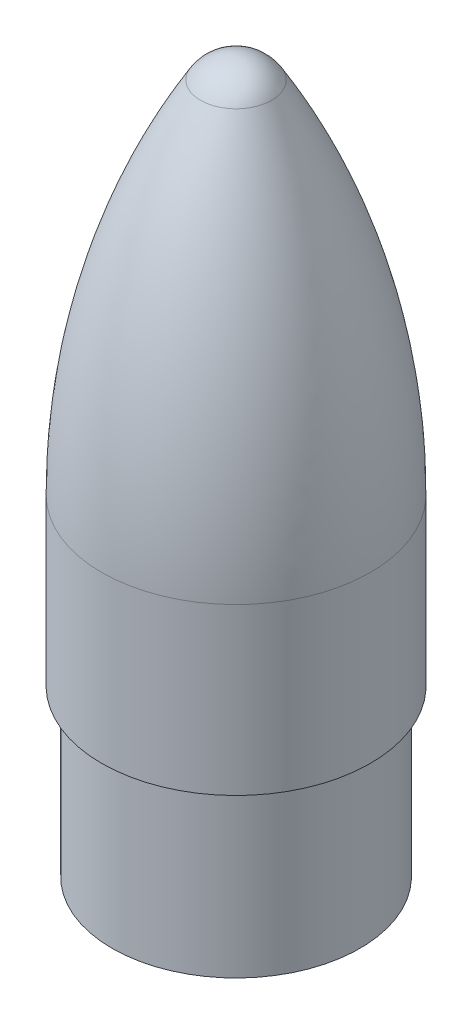
from build123d import *

# Parameters (mm, degrees)
SKETCH1_R           = 38.1
BOSS_EXTRUDE1_DEPTH = 50.8
SKETCH2_R           = 41.275
BOSS_EXTRUDE2_DEPTH = 50.8


with BuildPart() as part:
    # Sketch1 → Boss-Extrude1 (new body)
    with BuildSketch(Plane(origin=(0, 0, 0), x_dir=(1, 0, 0), z_dir=(0, 1, 0))):
        with Locations(Location((0, 0, 0), (0, 0, 270))):
            Circle(SKETCH1_R)
    extrude(amount=BOSS_EXTRUDE1_DEPTH)

    # Sketch2 → Boss-Extrude2 (add)
    with BuildSketch(Plane(origin=(0, 50.8, 0), x_dir=(1, 0, 0), z_dir=(0, 1, 0))):
        with Locations(Location((0, 0, 0), (0, 0, 270))):
            Circle(SKETCH2_R)
    extrude(amount=BOSS_EXTRUDE2_DEPTH)

    # Sketch3 → Revolve17 (revolve)
    with BuildSketch(Plane.XY):
        with BuildLine():
            Line((0, 214.429060371), (0, 218.239060371))
            ThreePointArc((0, 218.239060371), (-6.278456146, 216.578582298), (-10.915144585, 212.031350247))
            add(Edge.make_bspline(
                [(-41.275, 101.6), (-41.275, 101.930502855), (-41.273557103, 102.40564964), (-41.268747446, 103.512092248), (-41.257925909, 104.319246857), (-41.246383117, 105.163883335), (-41.228347866, 106.135820012), (-41.200734551, 107.334179726), (-41.159757311, 108.729726347), (-41.100846347, 110.335373987), (-41.029571588, 111.946697142), (-40.946255064, 113.558844584), (-40.850901423, 115.169512919), (-40.743515987, 116.779892998), (-40.624104745, 118.389166096), (-40.459816828, 120.399743968), (-40.238647793, 122.810299788), (-39.945617875, 125.619277994), (-39.562802148, 128.824148418), (-38.809156369, 134.422061303), (-36.96766496, 145.570323281), (-33.49128341, 160.52369707), (-28.30812049, 176.263796505), (-22.487129194, 190.02095936), (-18.428836954, 198.367582764), (-16.193226279, 202.662272388), (-14.657371604, 205.491195217), (-13.781700582, 207.066687496), (-13.19565908, 208.105983946), (-12.707159013, 208.962552916), (-12.311115433, 209.650979413), (-11.92041177, 210.324783551), (-11.526473808, 210.998380475), (-11.168679866, 211.6041541), (-10.999621727, 211.88932335), (-10.915144585, 212.031350247)],
                knots=[0.08301761, 0.08301761, 0.08301761, 0.08301761, 0.08301761, 0.094422695, 0.100125237, 0.105827779, 0.111530322, 0.117232864, 0.128637949, 0.140293389, 0.15194883, 0.163604271, 0.175259711, 0.186915153, 0.198570596, 0.210226038, 0.22188148, 0.245192344, 0.268503208, 0.291814091, 0.315124974, 0.408368487, 0.594855494, 0.734720752, 0.792997941, 0.839619695, 0.862930572, 0.87458601, 0.885991093, 0.891693634, 0.897396175, 0.903098717, 0.908801258, 0.914503799, 0.920206341, 0.920206341, 0.920206341, 0.920206341, 0.920206341], degree=4))
            Line((-41.275, 101.6), (-37.465, 101.6))
            add(Edge.make_bspline(
                [(-37.465, 101.6), (-37.465, 101.930502867), (-37.463557103, 102.405649652), (-37.458747445, 103.51209226), (-37.447925909, 104.31924687), (-37.436383117, 105.163883348), (-37.418347866, 106.135820025), (-37.39073455, 107.334179738), (-37.349757311, 108.729726359), (-37.290846347, 110.335373999), (-37.219571587, 111.946697154), (-37.136255063, 113.558844596), (-37.040901422, 115.169512931), (-36.933515986, 116.779893011), (-36.814104744, 118.389166108), (-36.649816827, 120.39974398), (-36.428647791, 122.8102998), (-36.135617873, 125.619278007), (-35.752802146, 128.82414843), (-34.999156367, 134.422061315), (-33.157664958, 145.570323293), (-29.681283406, 160.523697081), (-24.498120486, 176.263796517), (-18.677129189, 190.020959371), (-14.618836949, 198.367582775), (-12.383226273, 202.662272399), (-10.847371598, 205.491195228), (-9.971700576, 207.066687506), (-9.385659074, 208.105983957), (-8.897159007, 208.962552926), (-8.557849604, 209.552360704), (-8.32017223, 209.962884372), (-8.180293781, 210.203522785), (-8.13830032, 210.275674617)],
                knots=[0.08301761, 0.08301761, 0.08301761, 0.08301761, 0.08301761, 0.094422695, 0.100125237, 0.105827779, 0.111530322, 0.117232864, 0.128637949, 0.140293389, 0.15194883, 0.163604271, 0.175259711, 0.186915153, 0.198570596, 0.210226038, 0.22188148, 0.245192344, 0.268503208, 0.291814091, 0.315124974, 0.408368487, 0.594855494, 0.734720752, 0.792997941, 0.839619695, 0.862930572, 0.87458601, 0.885991093, 0.891693634, 0.897396175, 0.903098717, 0.905533648, 0.905533648, 0.905533648, 0.905533648, 0.905533648], degree=4))
            ThreePointArc((-8.13830032, 210.275674617), (-4.568439157, 213.330693141), (0, 214.429060371))
        make_face()
    revolve(axis=Axis((0, 0, 0), (0, 1, 0)))


solid = part.part
